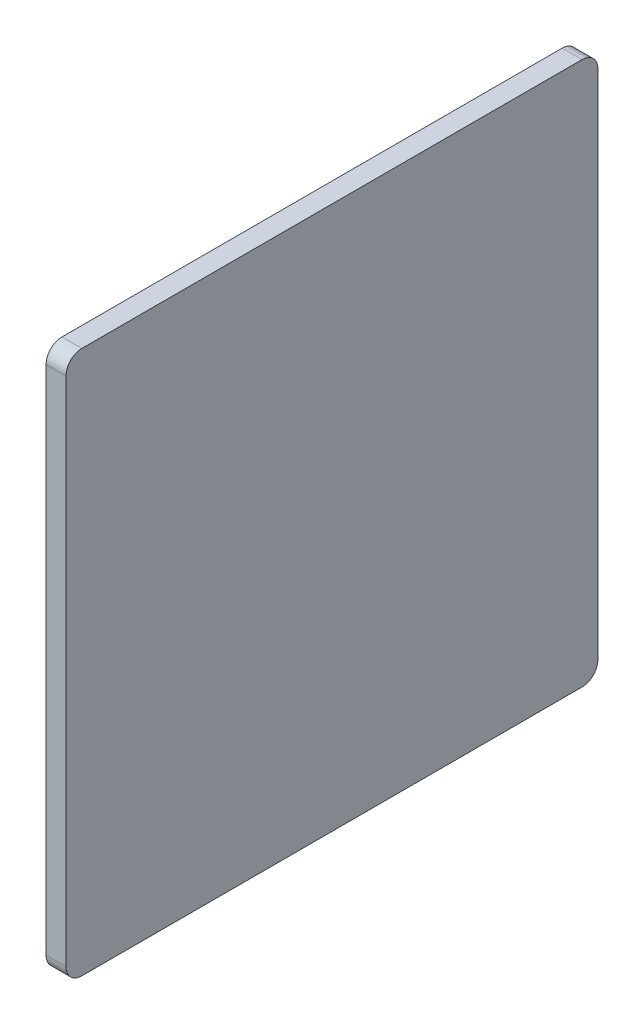
from build123d import *

# Parameters (mm, degrees)
SKETCH1_W           = 84.999999926
SKETCH1_H           = 86.825
BOSS_EXTRUDE1_DEPTH = 3.175
FILLET1_R           = 2.54


with BuildPart() as part:
    # Sketch1 → Boss-Extrude1 (new body)
    with BuildSketch(Plane(origin=(0, 0, 0), x_dir=(0, 0, -1), z_dir=(1, 0, 0))):
        Rectangle(SKETCH1_W, SKETCH1_H)
    extrude(amount=BOSS_EXTRUDE1_DEPTH)

    # Fillet1
    fillet1_edges = [part.edges().sort_by_distance(p)[0] for p in [
        (1.5875, 43.4125, 42.499999963),
        (1.5875, 43.4125, -42.499999963),
        (1.5875, -43.4125, -42.499999963),
        (1.5875, -43.4125, 42.499999963),
    ]]
    fillet(fillet1_edges, radius=FILLET1_R)


solid = part.part
